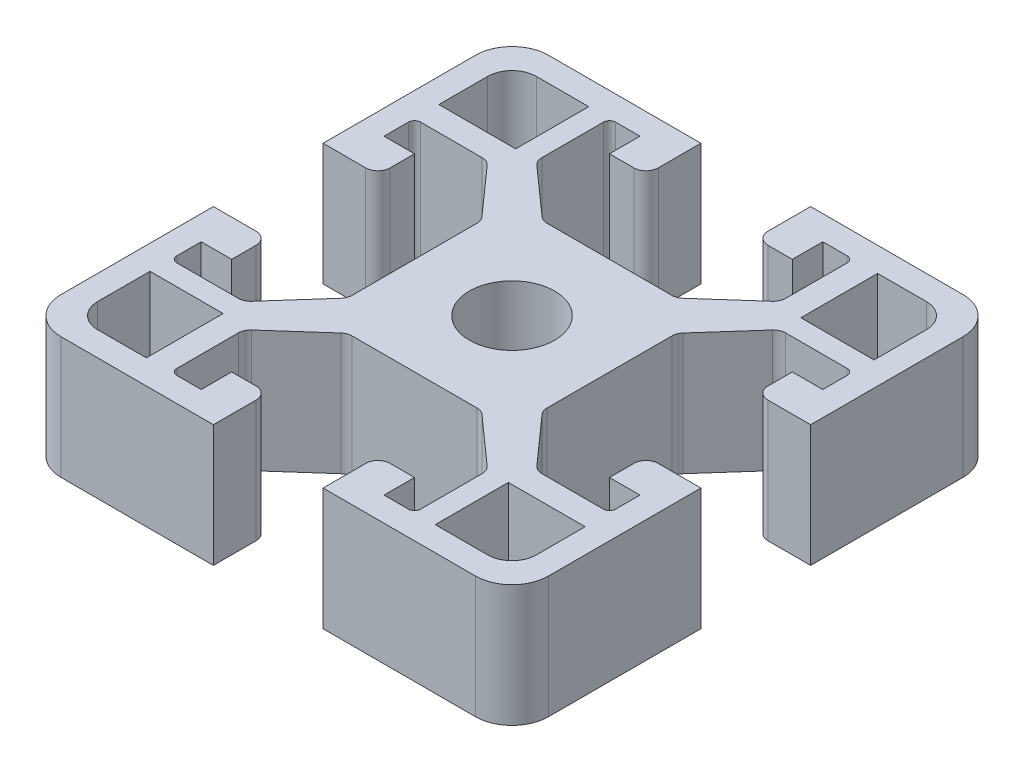
from build123d import *

# Parameters (mm, degrees)
SKETCH_1_R      = 3.5
EXTRUDE_1_DEPTH = 10


with BuildPart() as part:
    # 草图1 → 凸台-拉伸1 (new body)
    with BuildSketch(Plane(origin=(0, 0, 0), x_dir=(1, 0, 0), z_dir=(0, 1, 0))):
        with BuildLine():
            Line((11.701656746, 9.664363839), (8.252590681, 5.784164516))
            ThreePointArc((8.252590681, 5.784164516), (8.065278298, 5.475181235), (8, 5.119800678))
            Line((8, 5.119800678), (8, -5.119800678))
            ThreePointArc((8, -5.119800678), (8.065278298, -5.475181235), (8.252590681, -5.784164516))
            Line((8.252590681, -5.784164516), (11.701656746, -9.664363839))
            ThreePointArc((11.701656746, -9.664363839), (12.039410013, -9.912240056), (12.449066064, -10))
            Line((12.449066064, -10), (17.5, -10))
            ThreePointArc((17.5, -10), (17.853553391, -9.853553391), (18, -9.5))
            Line((18, -9.5), (18, -7.5))
            Line((18, -7.5), (15.5, -7.5))
            Line((15.5, -7.5), (15.5, -5.5))
            ThreePointArc((15.5, -5.5), (15.792893219, -4.792893219), (16.5, -4.5))
            Line((16.5, -4.5), (20, -4.5))
            Line((20, -4.5), (20, -17))
            ThreePointArc((20, -17), (19.121320344, -19.121320344), (17, -20))
            Line((17, -20), (4.5, -20))
            Line((4.5, -20), (4.5, -16.5))
            ThreePointArc((4.5, -16.5), (4.792893219, -15.792893219), (5.5, -15.5))
            Line((5.5, -15.5), (7.5, -15.5))
            Line((7.5, -15.5), (7.5, -18))
            Line((7.5, -18), (9.5, -18))
            ThreePointArc((9.5, -18), (9.853553391, -17.853553391), (10, -17.5))
            Line((10, -17.5), (10, -12.449066064))
            ThreePointArc((10, -12.449066064), (9.912240056, -12.039410013), (9.664363839, -11.701656746))
            Line((9.664363839, -11.701656746), (5.784164516, -8.252590681))
            ThreePointArc((5.784164516, -8.252590681), (5.475181235, -8.065278298), (5.119800678, -8))
            Line((5.119800678, -8), (-5.119800678, -8))
            ThreePointArc((-5.119800678, -8), (-5.475181235, -8.065278298), (-5.784164516, -8.252590681))
            Line((-5.784164516, -8.252590681), (-9.664363839, -11.701656746))
            ThreePointArc((-9.664363839, -11.701656746), (-9.912240056, -12.039410013), (-10, -12.449066064))
            Line((-10, -12.449066064), (-10, -17.5))
            ThreePointArc((-10, -17.5), (-9.853553391, -17.853553391), (-9.5, -18))
            Line((-9.5, -18), (-7.5, -18))
            Line((-7.5, -18), (-7.5, -15.5))
            Line((-7.5, -15.5), (-5.5, -15.5))
            ThreePointArc((-5.5, -15.5), (-4.792893219, -15.792893219), (-4.5, -16.5))
            Line((-4.5, -16.5), (-4.5, -20))
            Line((-4.5, -20), (-17, -20))
            ThreePointArc((-17, -20), (-19.121320344, -19.121320344), (-20, -17))
            Line((-20, -17), (-20, -4.5))
            Line((-20, -4.5), (-16.5, -4.5))
            ThreePointArc((-16.5, -4.5), (-15.792893219, -4.792893219), (-15.5, -5.5))
            Line((-15.5, -5.5), (-15.5, -7.5))
            Line((-15.5, -7.5), (-18, -7.5))
            Line((-18, -7.5), (-18, -9.5))
            ThreePointArc((-18, -9.5), (-17.853553391, -9.853553391), (-17.5, -10))
            Line((-17.5, -10), (-12.449066064, -10))
            ThreePointArc((-12.449066064, -10), (-12.039410013, -9.912240056), (-11.701656746, -9.664363839))
            Line((-11.701656746, -9.664363839), (-8.252590681, -5.784164516))
            ThreePointArc((-8.252590681, -5.784164516), (-8.065278298, -5.475181235), (-8, -5.119800678))
            Line((-8, -5.119800678), (-8, 5.119800678))
            ThreePointArc((-8, 5.119800678), (-8.065278298, 5.475181235), (-8.252590681, 5.784164516))
            Line((-8.252590681, 5.784164516), (-11.701656746, 9.664363839))
            ThreePointArc((-11.701656746, 9.664363839), (-12.039410013, 9.912240056), (-12.449066064, 10))
            Line((-12.449066064, 10), (-17.5, 10))
            ThreePointArc((-17.5, 10), (-17.853553391, 9.853553391), (-18, 9.5))
            Line((-18, 9.5), (-18, 7.5))
            Line((-18, 7.5), (-15.5, 7.5))
            Line((-15.5, 7.5), (-15.5, 5.5))
            ThreePointArc((-15.5, 5.5), (-15.792893219, 4.792893219), (-16.5, 4.5))
            Line((-16.5, 4.5), (-20, 4.5))
            Line((-20, 4.5), (-20, 17))
            ThreePointArc((-20, 17), (-19.121320344, 19.121320344), (-17, 20))
            Line((-17, 20), (-4.5, 20))
            Line((-4.5, 20), (-4.5, 16.5))
            ThreePointArc((-4.5, 16.5), (-4.792893219, 15.792893219), (-5.5, 15.5))
            Line((-5.5, 15.5), (-7.5, 15.5))
            Line((-7.5, 15.5), (-7.5, 18))
            Line((-7.5, 18), (-9.5, 18))
            ThreePointArc((-9.5, 18), (-9.853553391, 17.853553391), (-10, 17.5))
            Line((-10, 17.5), (-10, 12.449066064))
            ThreePointArc((-10, 12.449066064), (-9.912240056, 12.039410013), (-9.664363839, 11.701656746))
            Line((-9.664363839, 11.701656746), (-5.784164516, 8.252590681))
            ThreePointArc((-5.784164516, 8.252590681), (-5.475181235, 8.065278298), (-5.119800678, 8))
            Line((-5.119800678, 8), (5.119800678, 8))
            ThreePointArc((5.119800678, 8), (5.475181235, 8.065278298), (5.784164516, 8.252590681))
            Line((5.784164516, 8.252590681), (9.664363839, 11.701656746))
            ThreePointArc((9.664363839, 11.701656746), (9.912240056, 12.039410013), (10, 12.449066064))
            Line((10, 12.449066064), (10, 17.5))
            ThreePointArc((10, 17.5), (9.853553391, 17.853553391), (9.5, 18))
            Line((9.5, 18), (7.5, 18))
            Line((7.5, 18), (7.5, 15.5))
            Line((7.5, 15.5), (5.5, 15.5))
            ThreePointArc((5.5, 15.5), (4.792893219, 15.792893219), (4.5, 16.5))
            Line((4.5, 16.5), (4.5, 20))
            Line((4.5, 20), (17, 20))
            ThreePointArc((17, 20), (19.121320344, 19.121320344), (20, 17))
            Line((20, 17), (20, 4.5))
            Line((20, 4.5), (16.5, 4.5))
            ThreePointArc((16.5, 4.5), (15.792893219, 4.792893219), (15.5, 5.5))
            Line((15.5, 5.5), (15.5, 7.5))
            Line((15.5, 7.5), (18, 7.5))
            Line((18, 7.5), (18, 9.5))
            ThreePointArc((18, 9.5), (17.853553391, 9.853553391), (17.5, 10))
            Line((17.5, 10), (12.449066064, 10))
            ThreePointArc((12.449066064, 10), (12.039410013, 9.912240056), (11.701656746, 9.664363839))
        make_face()
        with Locations(Location((0, 0, 0), (0, 0, 270))):
            Circle(SKETCH_1_R, mode=Mode.SUBTRACT)
        with BuildLine():
            Line((18, -12), (11.701656746, -12))
            Line((11.701656746, -12), (11.701656746, -18))
            Line((11.701656746, -18), (16, -18))
            ThreePointArc((16, -18), (17.414213562, -17.414213562), (18, -16))
            Line((18, -16), (18, -12))
        make_face(mode=Mode.SUBTRACT)
        with BuildLine():
            Line((12, 18), (12, 11.701656746))
            Line((12, 11.701656746), (18, 11.701656746))
            Line((18, 11.701656746), (18, 16))
            ThreePointArc((18, 16), (17.414213562, 17.414213562), (16, 18))
            Line((16, 18), (12, 18))
        make_face(mode=Mode.SUBTRACT)
        with BuildLine():
            Line((-12, -18), (-12, -11.701656746))
            Line((-12, -11.701656746), (-18, -11.701656746))
            Line((-18, -11.701656746), (-18, -16))
            ThreePointArc((-18, -16), (-17.414213562, -17.414213562), (-16, -18))
            Line((-16, -18), (-12, -18))
        make_face(mode=Mode.SUBTRACT)
        with BuildLine():
            Line((-18, 12), (-11.701656746, 12))
            Line((-11.701656746, 12), (-11.701656746, 18))
            Line((-11.701656746, 18), (-16, 18))
            ThreePointArc((-16, 18), (-17.414213562, 17.414213562), (-18, 16))
            Line((-18, 16), (-18, 12))
        make_face(mode=Mode.SUBTRACT)
    extrude(amount=EXTRUDE_1_DEPTH)


solid = part.part
